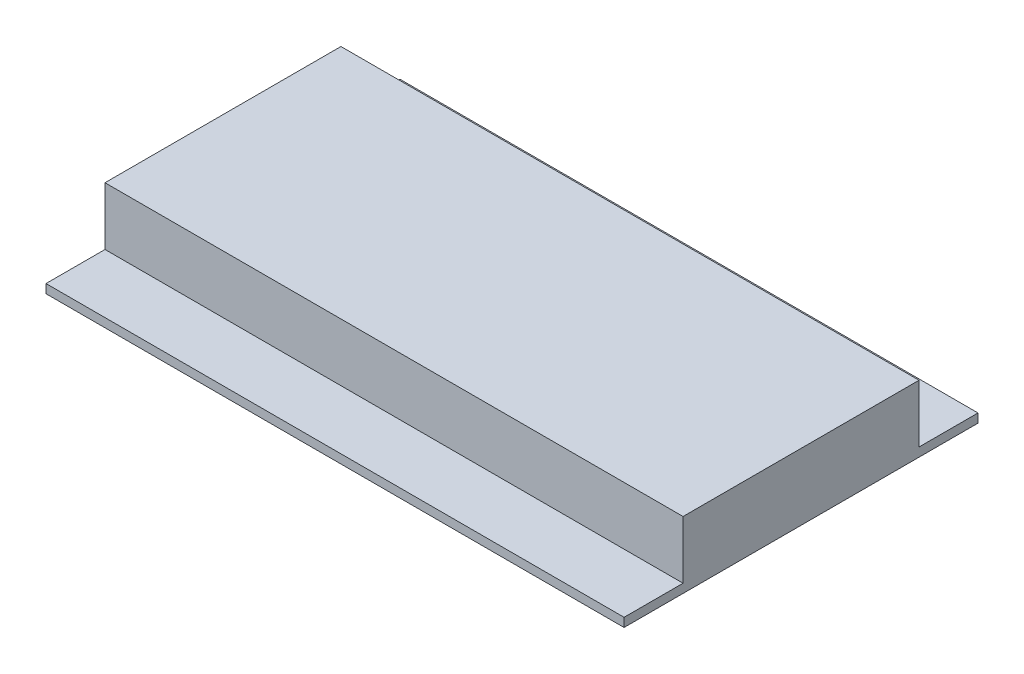
from build123d import *

# Parameters (mm, degrees)
SKETCH1_W           = 98
SKETCH1_H           = 60
BOSS_EXTRUDE1_DEPTH = 1.5
SKETCH2_W           = 98
SKETCH2_H           = 40
BOSS_EXTRUDE2_DEPTH = 9.8


with BuildPart() as part:
    # Sketch1 → Boss-Extrude1 (new body)
    with BuildSketch(Plane(origin=(0, 0, 0), x_dir=(1, 0, 0), z_dir=(0, 1, 0))):
        Rectangle(SKETCH1_W, SKETCH1_H)
    extrude(amount=BOSS_EXTRUDE1_DEPTH)

    # Sketch2 → Boss-Extrude2 (add)
    with BuildSketch(Plane(origin=(0, 1.5, 0), x_dir=(1, 0, 0), z_dir=(0, 1, 0))):
        Rectangle(SKETCH2_W, SKETCH2_H)
    extrude(amount=BOSS_EXTRUDE2_DEPTH)


solid = part.part
